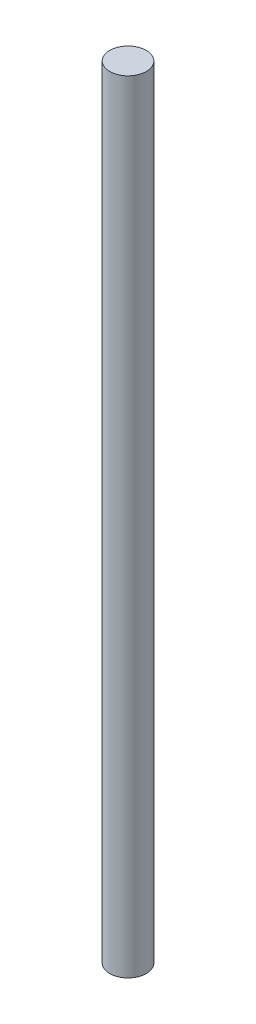
from build123d import *

# Parameters (mm, degrees)
SKETCH1_W = 1.1
SKETCH1_H = 47


with BuildPart() as part:
    # Sketch1 → Tendon (revolve)
    with BuildSketch(Plane.XY, mode=Mode.PRIVATE) as tendon_sk:
        with Locations((0.55, -23.5)):
            Rectangle(SKETCH1_W, SKETCH1_H)
    revolve(tendon_sk.sketch.rotate(Axis((0, -51, 0), (0, 1, 0)), 90), axis=Axis((0, -51, 0), (0, 1, 0)))


solid = part.part
